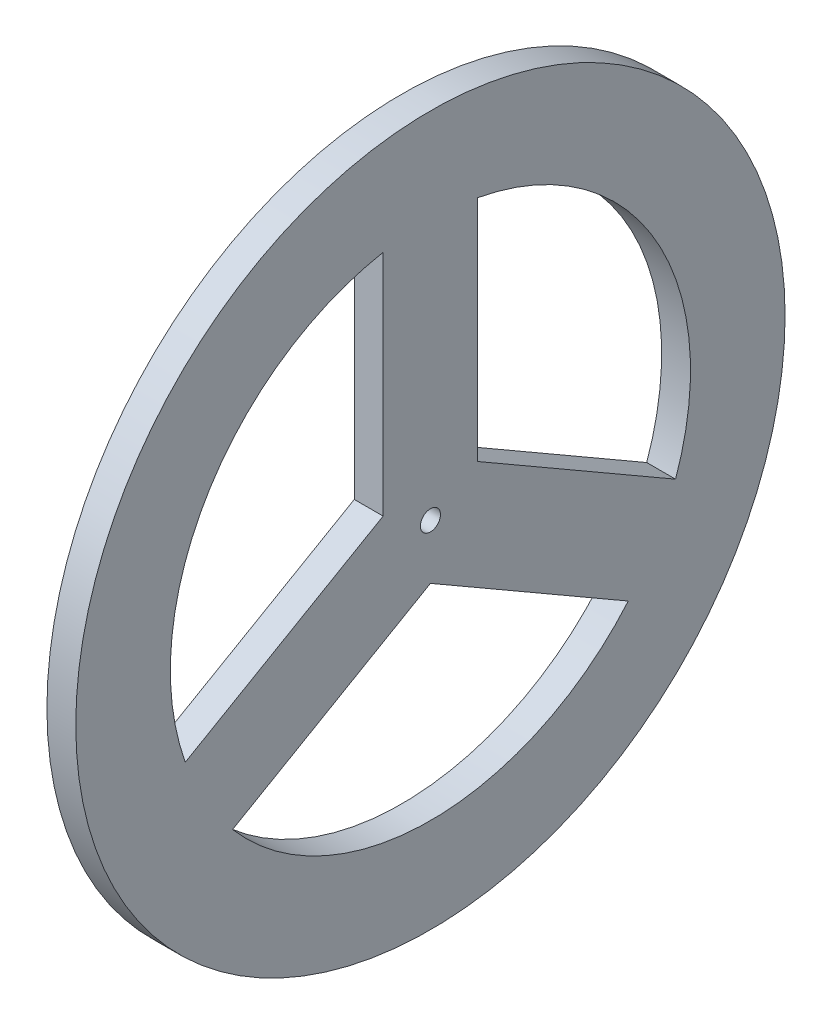
from build123d import *

# Parameters (mm, degrees)
SKETCH2_R           = 38.1
BOSS_EXTRUDE5_DEPTH = 3.0988
SKETCH2_3_R         = 1.0795
CUT_EXTRUDE3_DEPTH  = 54.970571254


with BuildPart() as part:
    # Sketch2 → Boss-Extrude5 (new body)
    with BuildSketch(Plane(origin=(0, 0, 0), x_dir=(0, 0, -1), z_dir=(1, 0, 0))):
        Circle(SKETCH2_R)
    extrude(amount=BOSS_EXTRUDE5_DEPTH)

    # Sketch2<3> → Cut-Extrude3 (cut, through all)
    with BuildSketch(Plane(origin=(0, 0, 0), x_dir=(0, 0, -1), z_dir=(1, 0, 0))):
        with BuildLine():
            Line((21.253442374, -18.136559411), (0, -5.865878735))
            Line((0, -5.865878735), (-21.253442374, -18.136559411))
            ThreePointArc((-21.253442374, -18.136559411), (0, -27.94), (21.253442374, -18.136559411))
        make_face()
        with BuildLine():
            Line((-26.333442374, -9.337741308), (-5.08, 2.932939367))
            Line((-5.08, 2.932939367), (-5.08, 27.474300719))
            ThreePointArc((-5.08, 27.474300719), (-24.196749782, 13.97), (-26.333442374, -9.337741308))
        make_face()
        with BuildLine():
            Line((5.08, 2.932939367), (26.333442374, -9.337741308))
            ThreePointArc((26.333442374, -9.337741308), (24.196749782, 13.97), (5.08, 27.474300719))
            Line((5.08, 27.474300719), (5.08, 2.932939367))
        make_face()
        Circle(SKETCH2_3_R)
    extrude(amount=CUT_EXTRUDE3_DEPTH, mode=Mode.SUBTRACT)


solid = part.part
